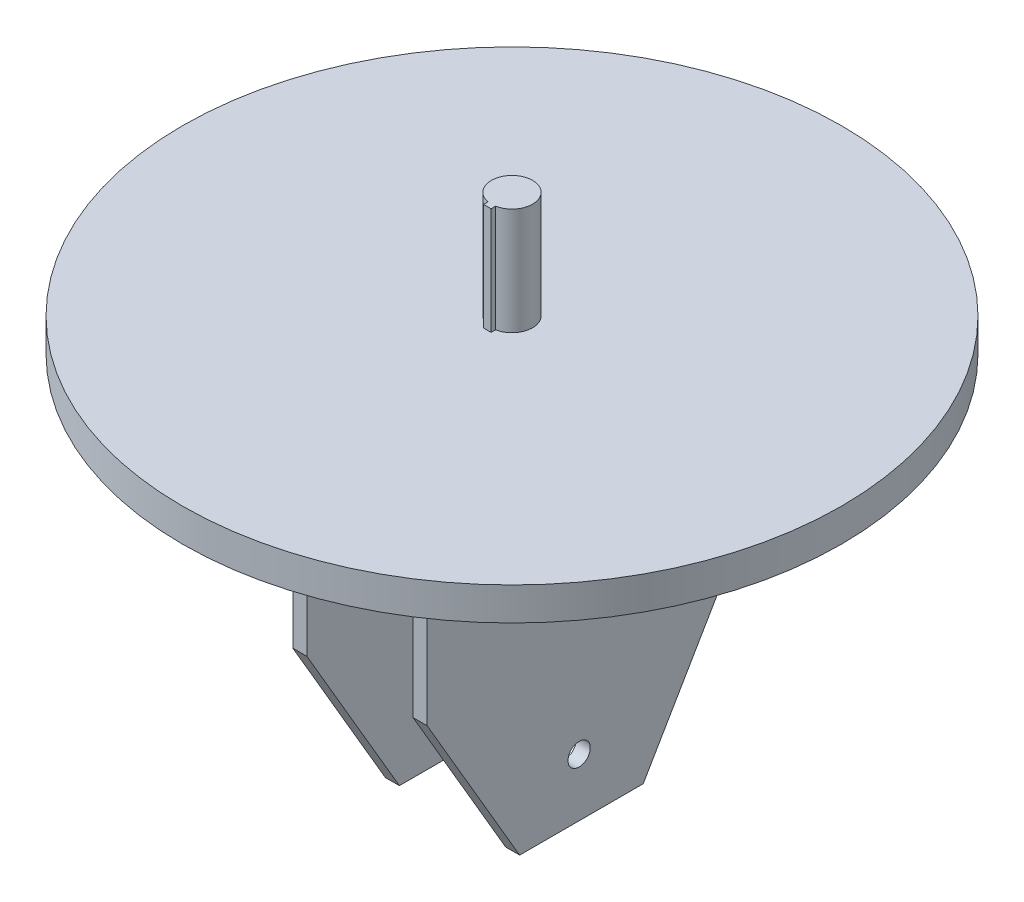
from build123d import *

# Parameters (mm, degrees)
SKETCH1_R               = 400
BOSS_EXTRUDE1_DEPTH     = 10
BOSS_EXTRUDE5_DEPTH     = 130
BOSS_EXTRUDE6_START     = -30
SKETCH1_4_R             = 400
BOSS_EXTRUDE6_DEPTH     = 30
SKETCH4_W               = 17
SKETCH4_H               = 369.202632894
SKETCH4_H_2             = 374.689720856
BOSS_EXTRUDE7_DEPTH     = 450
CUT_EXTRUDE1_DEPTH      = 789.823332566
CUT_EXTRUDE1_DEPTH_BACK = 300
SKETCH6_R               = 13.5
CUT_EXTRUDE2_DEPTH      = 300


with BuildPart() as part:
    # Sketch1 → Boss-Extrude1 (new body)
    with BuildSketch(Plane(origin=(0, 0, 0), x_dir=(1, 0, 0), z_dir=(0, 1, 0))):
        Circle(SKETCH1_R)
    extrude(amount=BOSS_EXTRUDE1_DEPTH)

    # Sketch3 → Boss-Extrude5 (add)
    with BuildSketch(Plane(origin=(0, 10, 0), x_dir=(1, 0, 0), z_dir=(0, 1, 0))):
        with BuildLine():
            Line((-4.6, -30.015), (4.6, -30.015))
            Line((4.6, -30.015), (4.6, -24.573156085))
            ThreePointArc((4.6, -24.573156085), (0, 25), (-4.6, -24.573156085))
            Line((-4.6, -24.573156085), (-4.6, -30.015))
        make_face()
    extrude(amount=BOSS_EXTRUDE5_DEPTH)

    # Sketch1<4> → Boss-Extrude6 (add)
    with BuildSketch(Plane(origin=(0, 0, 0), x_dir=(1, 0, 0), z_dir=(0, 1, 0)).offset(BOSS_EXTRUDE6_START)):
        Circle(SKETCH1_4_R)
    extrude(amount=BOSS_EXTRUDE6_DEPTH)

    # Sketch4 → Boss-Extrude7 (add)
    with BuildSketch(Plane.XZ.offset(30)):
        with Locations((-73, -0.045418377)):
            Rectangle(SKETCH4_W, SKETCH4_H)
        with Locations((73, -2.788962358)):
            Rectangle(SKETCH4_W, SKETCH4_H_2)
    extrude(amount=BOSS_EXTRUDE7_DEPTH)

    # Sketch5 → Cut-Extrude1 (cut, two sides: drawn at the far end of the back side and taken through both)
    with BuildSketch(Plane(origin=(81.5, 0, 0), x_dir=(0, 0, -1), z_dir=(1, 0, 0)).offset(-CUT_EXTRUDE1_DEPTH_BACK)):
        Polygon((-184.55589807, -287.770569758), (-72.211037642, -480), (-184.55589807, -480), align=None)
        Polygon((77.788962358, -480), (190.133822786, -287.770569758), (190.133822786, -480), align=None)
    extrude(amount=CUT_EXTRUDE1_DEPTH + CUT_EXTRUDE1_DEPTH_BACK, mode=Mode.SUBTRACT)

    # Sketch6 → Cut-Extrude2 (cut)
    with BuildSketch(Plane.ZY.offset(81.5)):
        with Locations((0, -410)):
            Circle(SKETCH6_R)
    extrude(amount=-CUT_EXTRUDE2_DEPTH, mode=Mode.SUBTRACT)


solid = part.part
